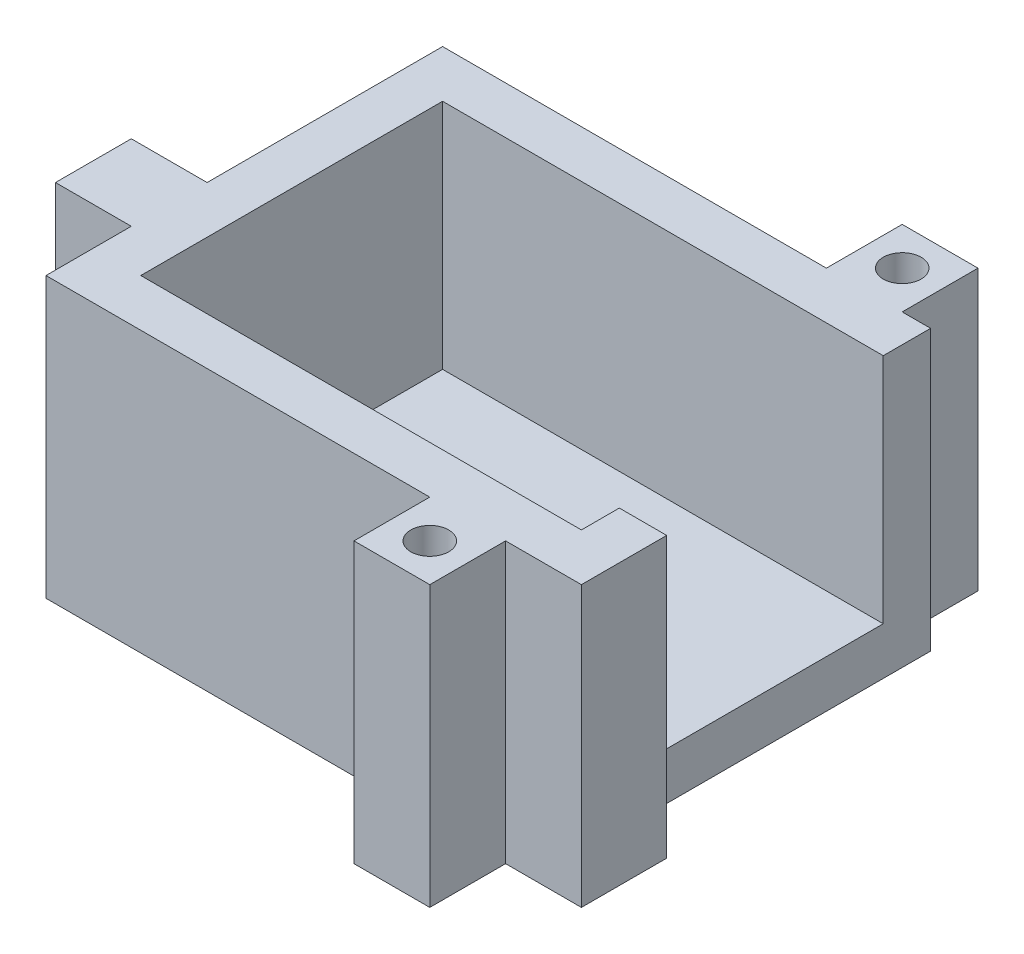
from build123d import *

# Parameters (mm, degrees)
BOSS_EXTRUDE1_DEPTH  = 24.5
SKETCH2_W            = 103
SKETCH2_H            = 41.85
BOSS_EXTRUDE2_DEPTH  = 5
SKETCH3_W            = 46.5
SKETCH3_H            = 27.85
CUT_EXTRUDE1_DEPTH   = 26
SKETCH7_W            = 8
SKETCH7_H            = 3
BOSS_EXTRUDE3_DEPTH  = 8
SKETCH8_R            = 2.5
CUT_EXTRUDE2_DEPTH   = 8
SKETCH9_W            = 8
SKETCH9_H            = 3
BOSS_EXTRUDE4_DEPTH  = 8
SKETCH10_R           = 2.5
CUT_EXTRUDE3_DEPTH   = 8
SKETCH12_W           = 11.5
SKETCH12_H           = 5
CUT_EXTRUDE4_DEPTH   = 8
SKETCH14_W           = 8
SKETCH14_H           = 3
BOSS_EXTRUDE5_DEPTH  = 8
SKETCH15_R           = 2.5
CUT_EXTRUDE5_DEPTH   = 8
SKETCH16_W           = 8
SKETCH16_H           = 29.5
BOSS_EXTRUDE6_DEPTH  = 8
SKETCH17_W           = 14
SKETCH17_H           = 29.5
BOSS_EXTRUDE7_DEPTH  = 8
SKETCH18_R           = 2
CUT_EXTRUDE6_DEPTH   = 10
SKETCH19_W           = 8
SKETCH19_H           = 29.5
BOSS_EXTRUDE8_DEPTH  = 8
SKETCH20_W           = 13
SKETCH20_H           = 13
BOSS_EXTRUDE9_DEPTH  = 88
CUT_EXTRUDE8_DEPTH   = 48
SKETCH23_R           = 2.5
CUT_EXTRUDE9_DEPTH   = 10
SKETCH25_W           = 8
SKETCH25_H           = 3
CUT_EXTRUDE10_DEPTH  = 8
SKETCH27_W           = 8
SKETCH27_H           = 29.5
BOSS_EXTRUDE11_DEPTH = 8
SKETCH28_R           = 2.5
CUT_EXTRUDE12_DEPTH  = 15
SKETCH29_W           = 13
SKETCH29_H           = 13
CUT_EXTRUDE13_DEPTH  = 88
SKETCH30_W           = 14
SKETCH30_H           = 8
CUT_EXTRUDE14_DEPTH  = 147


with BuildPart() as part:
    # Sketch1 → Boss-Extrude1 (new body)
    with BuildSketch(Plane(origin=(0, 0, 0), x_dir=(1, 0, 0), z_dir=(0, 1, 0))):
        Polygon((0, 0), (51.5, 0), (51.5, -5), (5, -5), (5, -36.85), (51.5, -36.85), (51.5, -32.85), (56.5, -32.85), (56.5, -41.85), (0, -41.85), align=None)
    extrude(amount=BOSS_EXTRUDE1_DEPTH)

    # Sketch2 → Boss-Extrude2 (add)
    with BuildSketch(Plane.XZ):
        with Locations((51.5, 20.925)):
            Rectangle(SKETCH2_W, SKETCH2_H)
    extrude(amount=BOSS_EXTRUDE2_DEPTH)

    # Sketch3 → Cut-Extrude1 (cut)
    with BuildSketch(Plane(origin=(0, 0, 0), x_dir=(1, 0, 0), z_dir=(0, 1, 0))):
        with Locations((74.75, -18.925)):
            Rectangle(SKETCH3_W, SKETCH3_H)
    extrude(amount=-CUT_EXTRUDE1_DEPTH, mode=Mode.SUBTRACT)

    # Sketch7 → Boss-Extrude3 (add)
    with BuildSketch(Plane.XY.offset(41.85)):
        with Locations((4, -3.5)):
            Rectangle(SKETCH7_W, SKETCH7_H)
    extrude(amount=BOSS_EXTRUDE3_DEPTH)

    # Sketch8 → Cut-Extrude2 (cut)
    with BuildSketch(Plane(origin=(0, -2, 0), x_dir=(1, 0, 0), z_dir=(0, 1, 0))):
        with Locations(Location((4, -45.85, 0), (0, 0, 270))):
            Circle(SKETCH8_R)
    extrude(amount=-CUT_EXTRUDE2_DEPTH, mode=Mode.SUBTRACT)

    # Sketch9 → Boss-Extrude4 (add)
    with BuildSketch(Plane(origin=(0, 0, 0), x_dir=(-1, 0, 0), z_dir=(0, 0, -1))):
        with Locations((-99, -3.5)):
            Rectangle(SKETCH9_W, SKETCH9_H)
    extrude(amount=BOSS_EXTRUDE4_DEPTH)

    # Sketch10 → Cut-Extrude3 (cut)
    with BuildSketch(Plane(origin=(0, -2, 0), x_dir=(1, 0, 0), z_dir=(0, 1, 0))):
        with Locations(Location((99, 3.996680608, 0), (0, 0, 270))):
            Circle(SKETCH10_R)
    extrude(amount=-CUT_EXTRUDE3_DEPTH, mode=Mode.SUBTRACT)

    # Sketch12 → Cut-Extrude4 (cut)
    with BuildSketch(Plane(origin=(0, 0, 0), x_dir=(1, 0, 0), z_dir=(0, 1, 0))):
        with Locations((89.25, -2.5)):
            Rectangle(SKETCH12_W, SKETCH12_H)
    extrude(amount=-CUT_EXTRUDE4_DEPTH, mode=Mode.SUBTRACT)

    # Sketch14 → Boss-Extrude5 (add)
    with BuildSketch(Plane(origin=(0, 0, 0), x_dir=(-1, 0, 0), z_dir=(0, 0, -1))):
        with Locations((-79.5, -3.5)):
            Rectangle(SKETCH14_W, SKETCH14_H)
    extrude(amount=BOSS_EXTRUDE5_DEPTH)

    # Sketch15 → Cut-Extrude5 (cut)
    with BuildSketch(Plane(origin=(0, -2, 0), x_dir=(1, 0, 0), z_dir=(0, 1, 0))):
        with Locations(Location((79.5, 4, 0), (0, 0, 270))):
            Circle(SKETCH15_R)
    extrude(amount=-CUT_EXTRUDE5_DEPTH, mode=Mode.SUBTRACT)

    # Sketch16 → Boss-Extrude6 (add)
    with BuildSketch(Plane(origin=(0, 0, 0), x_dir=(-1, 0, 0), z_dir=(0, 0, -1))):
        with Locations((-44.5, 9.75)):
            Rectangle(SKETCH16_W, SKETCH16_H)
    extrude(amount=BOSS_EXTRUDE6_DEPTH)

    # Sketch17 → Boss-Extrude7 (add)
    with BuildSketch(Plane.XY.offset(41.85)):
        with Locations((41.5, 9.75)):
            Rectangle(SKETCH17_W, SKETCH17_H)
    extrude(amount=BOSS_EXTRUDE7_DEPTH)

    # Sketch18 → Cut-Extrude6 (cut)
    with BuildSketch(Plane(origin=(0, 24.5, 0), x_dir=(1, 0, 0), z_dir=(0, 1, 0))):
        with Locations(Location((44.5, 4, 0), (0, 0, 270))):
            Circle(SKETCH18_R)
        with Locations(Location((44.5, -45.85, 0), (0, 0, 270))):
            Circle(SKETCH18_R)
    extrude(amount=-CUT_EXTRUDE6_DEPTH, mode=Mode.SUBTRACT)

    # Sketch19 → Boss-Extrude8 (add)
    with BuildSketch(Plane.ZY.offset(-34.5)):
        with Locations((45.85, 9.75)):
            Rectangle(SKETCH19_W, SKETCH19_H)
    extrude(amount=BOSS_EXTRUDE8_DEPTH)

    # Sketch20 → Boss-Extrude9 (add)
    with BuildSketch(Plane(origin=(0, 24.5, 0), x_dir=(1, 0, 0), z_dir=(0, 1, 0))):
        with Locations((33, -43.35)):
            Rectangle(SKETCH20_W, SKETCH20_H)
    extrude(amount=BOSS_EXTRUDE9_DEPTH)

    # Sketch22 → Cut-Extrude8 (cut)
    with BuildSketch(Plane(origin=(0, 0, 0), x_dir=(1, 0, 0), z_dir=(0, 1, 0))):
        Polygon((103, 0), (103, 8), (51.5, 8), (51.5, -32.85), (56.5, -32.85), (98, -32.85), (98, -5), (95, -5), (95, 0), align=None)
        Polygon((103, -41.85), (103, -32.85), (98, -32.85), (56.5, -32.85), (56.5, -41.85), align=None)
        Polygon((103, -32.85), (103, 0), (95, 0), (95, -5), (98, -5), (98, -32.85), align=None)
    extrude(amount=-CUT_EXTRUDE8_DEPTH, mode=Mode.SUBTRACT)

    # Sketch23 → Cut-Extrude9 (cut)
    with BuildSketch(Plane.XZ.offset(5)):
        with Locations(Location((44.5, -4, 0), (0, 0, 270))):
            Circle(SKETCH23_R)
    extrude(amount=-CUT_EXTRUDE9_DEPTH, mode=Mode.SUBTRACT)

    # Sketch25 → Cut-Extrude10 (cut)
    with BuildSketch(Plane.XY.offset(49.85)):
        with Locations((4, -3.5)):
            Rectangle(SKETCH25_W, SKETCH25_H)
    extrude(amount=-CUT_EXTRUDE10_DEPTH, mode=Mode.SUBTRACT)

    # Sketch27 → Boss-Extrude11 (add)
    with BuildSketch(Plane.ZY):
        with Locations((28.85, 9.75)):
            Rectangle(SKETCH27_W, SKETCH27_H)
    extrude(amount=BOSS_EXTRUDE11_DEPTH)

    # Sketch28 → Cut-Extrude12 (cut)
    with BuildSketch(Plane.XZ.offset(5)):
        with Locations(Location((-4, 28.85, 0), (0, 0, 270))):
            Circle(SKETCH28_R)
    extrude(amount=-CUT_EXTRUDE12_DEPTH, mode=Mode.SUBTRACT)

    # Sketch29 → Cut-Extrude13 (cut)
    with BuildSketch(Plane(origin=(0, 112.5, 0), x_dir=(1, 0, 0), z_dir=(0, 1, 0))):
        with Locations((33, -43.35)):
            Rectangle(SKETCH29_W, SKETCH29_H)
    extrude(amount=-CUT_EXTRUDE13_DEPTH, mode=Mode.SUBTRACT)

    # Sketch30 → Cut-Extrude14 (cut)
    with BuildSketch(Plane.XZ.offset(5)):
        with Locations((33.5, 45.85)):
            Rectangle(SKETCH30_W, SKETCH30_H)
    extrude(amount=-CUT_EXTRUDE14_DEPTH, mode=Mode.SUBTRACT)


solid = part.part
